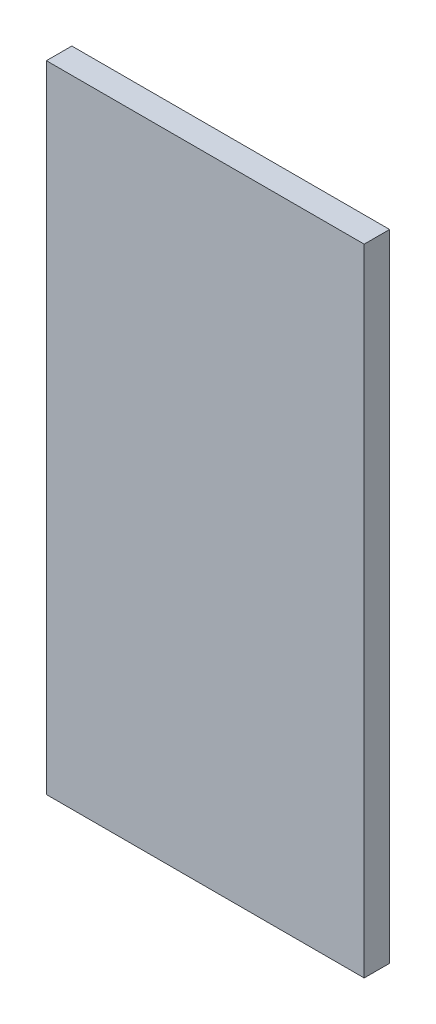
from build123d import *

# Parameters (mm, degrees)
SKETCH1_R           = 17.5
BOSS_EXTRUDE1_DEPTH = 1.5
SKETCH2_R           = 40
BOSS_EXTRUDE2_DEPTH = 6.5
SKETCH3_W           = 250
SKETCH3_H           = 500
BOSS_EXTRUDE3_DEPTH = 20
FILLET2_R           = 1


with BuildPart() as part:
    # Sketch1 → Boss-Extrude1 (new body)
    with BuildSketch(Plane.XY):
        Circle(SKETCH1_R)
    extrude(amount=BOSS_EXTRUDE1_DEPTH)

    # Sketch2 → Boss-Extrude2 (add)
    with BuildSketch(Plane.XY.offset(1.5)):
        with Locations(Location((0, 0, 0), (0, 0, 180))):
            Circle(SKETCH2_R)
    extrude(amount=BOSS_EXTRUDE2_DEPTH)

    # Sketch3 → Boss-Extrude3 (add)
    with BuildSketch(Plane.XY.offset(8)):
        Rectangle(SKETCH3_W, SKETCH3_H)
    extrude(amount=BOSS_EXTRUDE3_DEPTH)

    # Fillet2
    fillet2_edges = [part.edges().sort_by_distance(p)[0] for p in [
        (40, 0, 8),
    ]]
    fillet(fillet2_edges, radius=FILLET2_R)


solid = part.part
